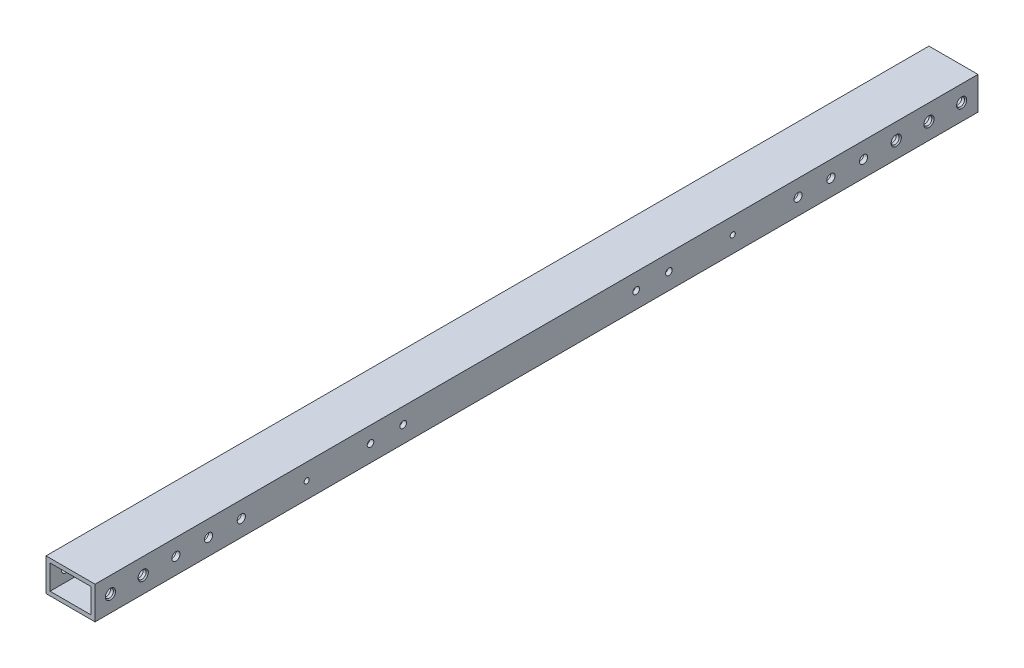
from build123d import *

# Parameters (mm, degrees)
BOSS_EXTRUDE1_DEPTH                  = 342.9
BOSS_EXTRUDE1_DEPTH_BACK             = 342.9
SKETCH3_W                            = 38.1
SKETCH3_H                            = 25.4
SKETCH3_W_2                          = 31.75
SKETCH3_H_2                          = 19.05
F_1_4_0_25_DIAMETER_HOLE2_AT_2_COUNT = 2
F_1_4_0_25_DIAMETER_HOLE2_AT_2_PITCH = 25.4
F_1_4_0_25_DIAMETER_HOLE2_AT_3_COUNT = 2
F_1_4_0_25_DIAMETER_HOLE2_AT_3_PITCH = 661.111799988
F_1_4_0_25_DIAMETER_HOLE2_AT_4_COUNT = 2
F_1_4_0_25_DIAMETER_HOLE2_AT_4_PITCH = 50.8
F_1_4_0_25_DIAMETER_HOLE2_AT_5_COUNT = 2
F_1_4_0_25_DIAMETER_HOLE2_AT_5_PITCH = 635.711799988
F_1_4_0_25_DIAMETER_HOLE3_D          = 6.35
F_5_32_0_15625_DIAMETER_HOLE1_D      = 3.96875
F_10_CLEARANCE_HOLE1_D               = 5.1054


with BuildPart() as part:
    # Sketch3 → Boss-Extrude1 (new, two sides: drawn at the far end of the back side and taken through both)
    with BuildSketch(Plane.XY.offset(-BOSS_EXTRUDE1_DEPTH_BACK)):
        Rectangle(SKETCH3_W, SKETCH3_H)
        Rectangle(SKETCH3_W_2, SKETCH3_H_2, mode=Mode.SUBTRACT)
    extrude(amount=BOSS_EXTRUDE1_DEPTH + BOSS_EXTRUDE1_DEPTH_BACK)

    # Sketch8 → 1/4 (0.25) Diameter Hole2 (revolve, cut)
    with BuildSketch(Plane(origin=(-19.05, 0, -330.2), x_dir=(0, 0, 1), z_dir=(0, 1, 0))):
        Polygon((0, 0), (0, 38.1), (3.9624, 38.1), (3.175, 37.194199916), (3.175, 0), align=None)
    f_1_4_0_25_diameter_hole2 = revolve(axis=Axis((-25.4, 0, -330.2), (1, 0, 0)), mode=Mode.SUBTRACT)

    # 1/4 (0.25) Diameter Hole2 at 2: 1/4 (0.25) Diameter Hole2 ×2
    with Locations(*[(0, 0, i * F_1_4_0_25_DIAMETER_HOLE2_AT_2_PITCH) for i in range(1, F_1_4_0_25_DIAMETER_HOLE2_AT_2_COUNT)]):
        add(f_1_4_0_25_diameter_hole2, mode=Mode.SUBTRACT)

    # 1/4 (0.25) Diameter Hole2 at 3: 1/4 (0.25) Diameter Hole2 ×2
    with Locations(*[(0, 0, i * F_1_4_0_25_DIAMETER_HOLE2_AT_3_PITCH) for i in range(1, F_1_4_0_25_DIAMETER_HOLE2_AT_3_COUNT)]):
        add(f_1_4_0_25_diameter_hole2, mode=Mode.SUBTRACT)

    # 1/4 (0.25) Diameter Hole2 at 4: 1/4 (0.25) Diameter Hole2 ×2
    with Locations(*[(0, 0, i * F_1_4_0_25_DIAMETER_HOLE2_AT_4_PITCH) for i in range(1, F_1_4_0_25_DIAMETER_HOLE2_AT_4_COUNT)]):
        add(f_1_4_0_25_diameter_hole2, mode=Mode.SUBTRACT)

    # 1/4 (0.25) Diameter Hole2 at 5: 1/4 (0.25) Diameter Hole2 ×2
    with Locations(*[(0, 0, i * F_1_4_0_25_DIAMETER_HOLE2_AT_5_PITCH) for i in range(1, F_1_4_0_25_DIAMETER_HOLE2_AT_5_COUNT)]):
        add(f_1_4_0_25_diameter_hole2, mode=Mode.SUBTRACT)

    # 1/4 (0.25) Diameter Hole3 (through all)
    with Locations(Plane(origin=(19.05, 0, 0), x_dir=(0, 0, -1), z_dir=(1, 0, 0))):
        with Locations((-280.111799988, 0), (-254.711799988, 0), (-229.311799988, 0), (254, 0), (228.6, 0), (203.2, 0)):
            Hole(F_1_4_0_25_DIAMETER_HOLE3_D / 2)

    # 5/32 (0.15625) Diameter Hole1 (through all)
    with Locations(Plane(origin=(19.05, 0, 0), x_dir=(0, 0, -1), z_dir=(1, 0, 0))):
        with Locations((152.4, 0), (-178.511799988, 0)):
            Hole(F_5_32_0_15625_DIAMETER_HOLE1_D / 2)

    # #10 Clearance Hole1 (through all)
    with Locations(Plane(origin=(19.05, 0, 0), x_dir=(0, 0, -1), z_dir=(1, 0, 0))):
        with Locations((-128.943395188, 0.344528206), (-103.543395188, 0.344528206), (77.4315952, -0.000599988), (102.8315952, -0.000599988)):
            Hole(F_10_CLEARANCE_HOLE1_D / 2)


solid = part.part
